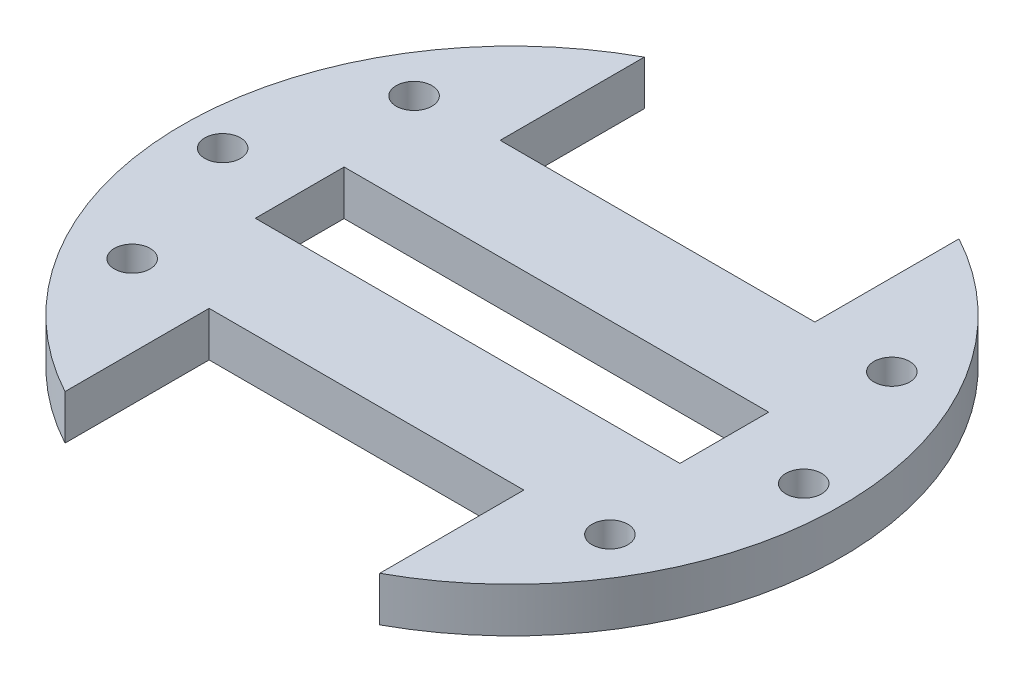
from build123d import *

# Parameters (mm, degrees)
SKETCH_1_R          = 29.5
EXTRUDE_1_DEPTH     = 4
SKETCH_2_W          = 28.166253132
SKETCH_2_H          = 32.95394871
CUT_EXTRUDE_1_DEPTH = 42.910619179
SKETCH_3_W          = 38
SKETCH_3_H          = 7.946399408
CUT_EXTRUDE_2_DEPTH = 40.47360569
SKETCH_6_R          = 1.6
CUT_EXTRUDE_5_DEPTH = 40.47360569


with BuildPart() as part:
    # 草图1 → 凸台-拉伸1 (new body)
    with BuildSketch(Plane(origin=(0, 0, 0), x_dir=(1, 0, 0), z_dir=(0, 1, 0))):
        with Locations(Location((0, 0, 0), (0, 0, 270))):
            Circle(SKETCH_1_R)
    extrude(amount=EXTRUDE_1_DEPTH)

    # 草图2 → 切除-拉伸1 (cut, through all)
    with BuildSketch(Plane(origin=(0, 4, 0), x_dir=(1, 0, 0), z_dir=(0, 1, 0))):
        with Locations((0, 29.5)):
            Rectangle(SKETCH_2_W, SKETCH_2_H)
        with Locations((0, -29.5)):
            Rectangle(SKETCH_2_W, SKETCH_2_H)
    extrude(amount=-CUT_EXTRUDE_1_DEPTH, mode=Mode.SUBTRACT)

    # 草图3 → 切除-拉伸2 (cut, through all)
    with BuildSketch(Plane(origin=(0, 4, 0), x_dir=(1, 0, 0), z_dir=(0, 1, 0))):
        Rectangle(SKETCH_3_W, SKETCH_3_H)
    extrude(amount=-CUT_EXTRUDE_2_DEPTH, mode=Mode.SUBTRACT)

    # 草图6 → 切除-拉伸5 (cut, through all)
    with BuildSketch(Plane(origin=(0, 4, 0), x_dir=(1, 0, 0), z_dir=(0, 1, 0))):
        with Locations(Location((-25.893583016, 0, 0), (0, 0, 270))):
            Circle(SKETCH_6_R)
        with Locations(Location((26.106416984, 0, 0), (0, 0, 270))):
            Circle(SKETCH_6_R)
        with Locations(Location((-21.376, 12.613, 0), (0, 0, 270))):
            Circle(SKETCH_6_R)
        with Locations(Location((21.376, 12.613, 0), (0, 0, 270))):
            Circle(SKETCH_6_R)
        with Locations(Location((-21.376, -12.613, 0), (0, 0, 270))):
            Circle(SKETCH_6_R)
        with Locations(Location((21.376, -12.613, 0), (0, 0, 270))):
            Circle(SKETCH_6_R)
    extrude(amount=-CUT_EXTRUDE_5_DEPTH, mode=Mode.SUBTRACT)


solid = part.part
